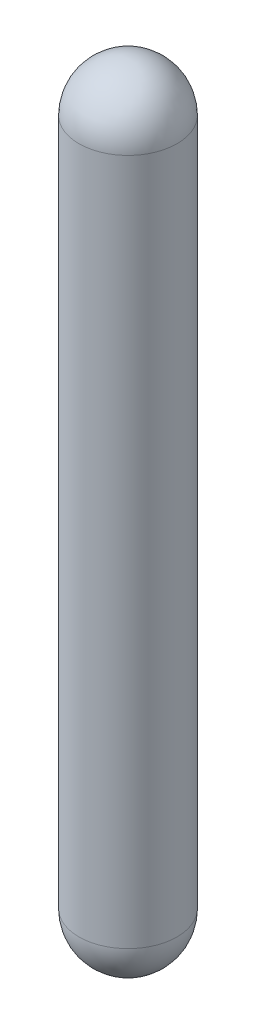
from build123d import *

# Parameters (mm, degrees)
SKETCH1_R           = 3.175
BOSS_EXTRUDE1_DEPTH = 25.4
FILLET1_R           = 3.175


with BuildPart() as part:
    # Sketch1 → Boss-Extrude1 (new, symmetric)
    with BuildSketch(Plane(origin=(0, 0, 0), x_dir=(1, 0, 0), z_dir=(0, 1, 0))):
        with Locations(Location((0, 0, 0), (0, 0, 270))):
            Circle(SKETCH1_R)
    extrude(amount=BOSS_EXTRUDE1_DEPTH, both=True)

    # Fillet1
    fillet1_edges = [part.edges().sort_by_distance(p)[0] for p in [
        (0, -25.4, -3.175),
        (0, 25.4, -3.175),
    ]]
    fillet(fillet1_edges, radius=FILLET1_R)


solid = part.part
